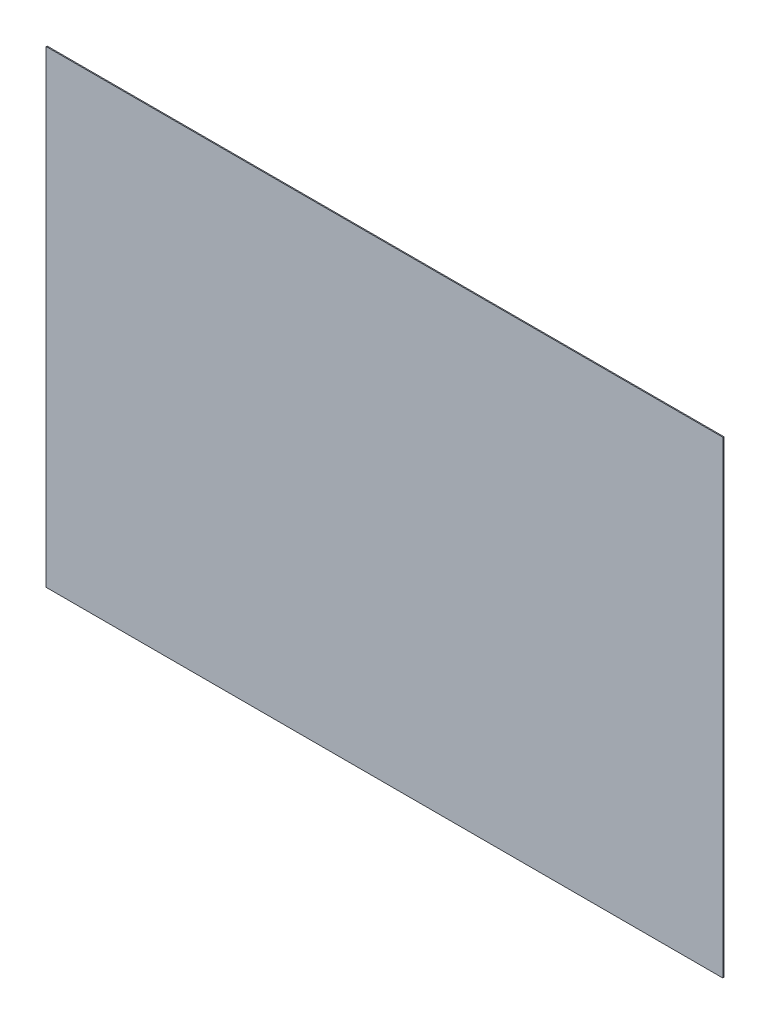
from build123d import *

# Parameters (mm, degrees)
CROQUIS1_W              = 1300
CROQUIS1_H              = 900
SALIENTE_EXTRUIR1_DEPTH = 1.92


with BuildPart() as part:
    # Croquis1 → Saliente-Extruir1 (new body)
    with BuildSketch(Plane.XY):
        Rectangle(CROQUIS1_W, CROQUIS1_H)
    extrude(amount=SALIENTE_EXTRUIR1_DEPTH)


solid = part.part
